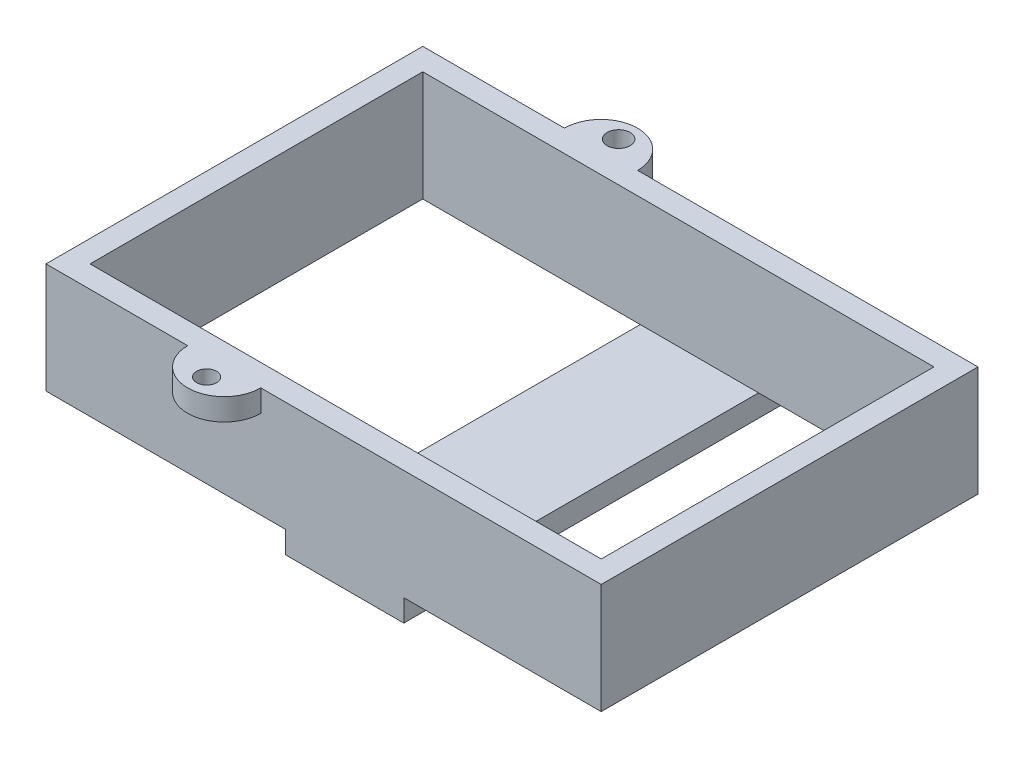
from build123d import *

# Parameters (mm, degrees)
SKETCH1_W           = 64.008
SKETCH1_H           = 43.434
SKETCH1_W_2         = 58.928
SKETCH1_H_2         = 38.354
BOSS_EXTRUDE1_DEPTH = 12.7
SKETCH2_W           = 13.638305883
SKETCH2_H           = 43.434
BOSS_EXTRUDE2_DEPTH = 2.54
SKETCH3_R           = 1.327962253
SKETCH3_R_2         = 1.146659907
BOSS_EXTRUDE3_DEPTH = 2.54


with BuildPart() as part:
    # Sketch1 → Boss-Extrude1 (new body)
    with BuildSketch(Plane(origin=(0, 0, 0), x_dir=(1, 0, 0), z_dir=(0, 1, 0))):
        with Locations((-2.584823529, -0.216647059)):
            Rectangle(SKETCH1_W, SKETCH1_H)
        with Locations((-2.584823529, -0.216647059)):
            Rectangle(SKETCH1_W_2, SKETCH1_H_2, mode=Mode.SUBTRACT)
    extrude(amount=-BOSS_EXTRUDE1_DEPTH)

    # Sketch2 → Boss-Extrude2 (add)
    with BuildSketch(Plane.XZ.offset(12.7)):
        with Locations((-0.158376471, 0.216647059)):
            Rectangle(SKETCH2_W, SKETCH2_H)
    extrude(amount=BOSS_EXTRUDE2_DEPTH)

    # Sketch3 → Boss-Extrude3 (add)
    # profile 1 of 2: a face of its own
    with BuildSketch(Plane(origin=(0, 0, 0), x_dir=(1, 0, 0), z_dir=(0, 1, 0))):
        with BuildLine():
            ThreePointArc((-9.823823529, 21.500352941), (-14.039870548, 25.716399959), (-18.255917566, 21.500352941))
            Line((-18.255917566, 21.500352941), (-9.823823529, 21.500352941))
        make_face()
        with Locations(Location((-14.039870548, 23.532352941, 0), (0, 0, 270))):
            Circle(SKETCH3_R, mode=Mode.SUBTRACT)
    # profile 2 of 2: a face of its own
    with BuildSketch(Plane(origin=(0, 0, 0), x_dir=(1, 0, 0), z_dir=(0, 1, 0))):
        with BuildLine():
            ThreePointArc((-18.255917566, -21.933647059), (-14.039870548, -26.149694077), (-9.823823529, -21.933647059))
            Line((-9.823823529, -21.933647059), (-18.255917566, -21.933647059))
        make_face()
        with Locations(Location((-14.039870548, -23.965647059, 0), (0, 0, 270))):
            Circle(SKETCH3_R_2, mode=Mode.SUBTRACT)
    extrude(amount=-BOSS_EXTRUDE3_DEPTH)


solid = part.part
